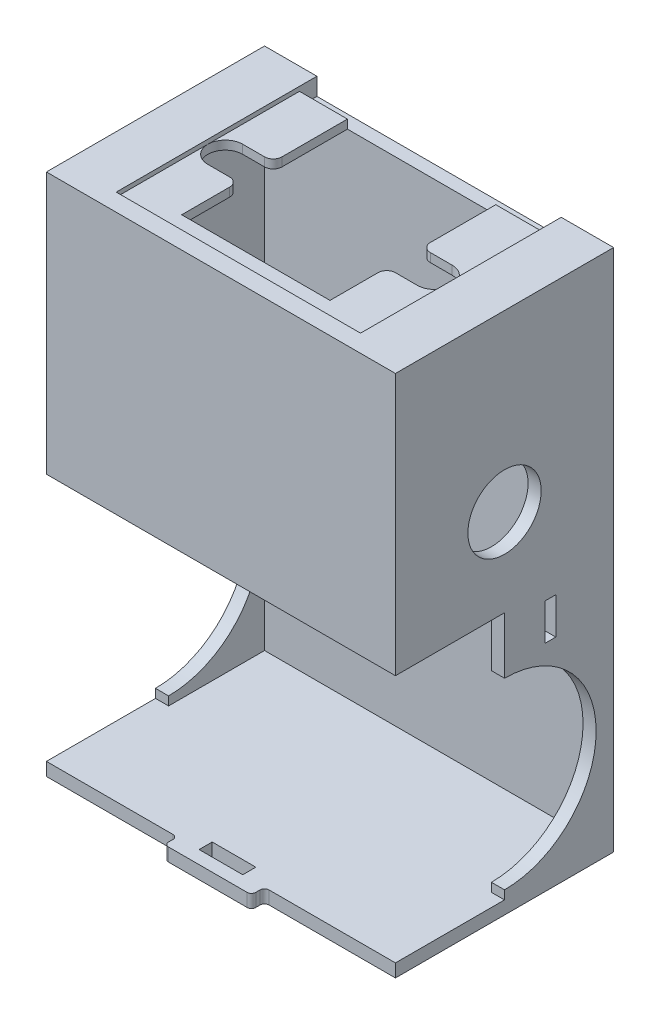
from build123d import *

# Parameters (mm, degrees)
SKETCH_1_W           = 40
SKETCH_1_H           = 60
EXTRUDE_1_DEPTH      = 25
SHELL_1_T            = -1.5
SKETCH_2_R           = 10.5
CUT_EXTRUDE_1_DEPTH  = 75
SKETCH_3_W           = 40
SKETCH_3_H           = 30
EXTRUDE_2_DEPTH      = 1
SKETCH_4_W           = 40
SKETCH_4_H           = 28.5
CUT_EXTRUDE_2_DEPTH  = 12.5
SKETCH_5_R           = 4.2
CUT_EXTRUDE_3_DEPTH  = 1.5
SKETCH_6_W           = 28
SKETCH_6_H           = 26
CUT_EXTRUDE_4_DEPTH  = 0.5
CUT_EXTRUDE_7_DEPTH  = 3.5
SKETCH_9_W           = 28
SKETCH_9_H           = 2
CUT_EXTRUDE_8_DEPTH  = 0.5
FILLET_1_R           = 1
CUT_EXTRUDE_9_DEPTH  = 1.5
SKETCH_18_W          = 10
SKETCH_18_H          = 1.5
EXTRUDE_6_DEPTH      = 1.5
SKETCH_22_W          = 5
SKETCH_22_H          = 1.5
CUT_EXTRUDE_13_DEPTH = 2
FILLET_4_R           = 0.5
SKETCH_26_W          = 1.25
SKETCH_26_H          = 4.2
CUT_EXTRUDE_15_DEPTH = 41
FILLET_5_R           = 0.2
SKETCH_17_R          = 4.2
CUT_EXTRUDE_16_DEPTH = 41
EXTRUDE_START        = 1.5
EXTRUDE_9_DEPTH      = 1.5


with BuildPart() as part:
    # 草图1 → 凸台-拉伸1 (new body)
    with BuildSketch(Plane.XY):
        Rectangle(SKETCH_1_W, SKETCH_1_H)
    extrude(amount=EXTRUDE_1_DEPTH)

    # 抽壳1
    shell_1_openings = [part.faces().sort_by_distance(p)[0] for p in [
        (0, 0, 25),
    ]]
    offset(amount=SHELL_1_T, openings=shell_1_openings, kind=Kind.INTERSECTION)

    # 草图2 → 切除-拉伸1 (cut)
    with BuildSketch(Plane(origin=(20, 0, 0), x_dir=(0, 0, -1), z_dir=(1, 0, 0))):
        with Locations((-12.5, -17)):
            Circle(SKETCH_2_R)
    extrude(amount=-CUT_EXTRUDE_1_DEPTH, mode=Mode.SUBTRACT)

    # 草图3 → 凸台-拉伸2 (add)
    with BuildSketch(Plane.XY.offset(25)):
        with Locations((0, 15)):
            Rectangle(SKETCH_3_W, SKETCH_3_H)
    extrude(amount=-EXTRUDE_2_DEPTH)

    # 草图4 → 切除-拉伸2 (cut)
    with BuildSketch(Plane.XY.offset(25)):
        with Locations((0, -14.25)):
            Rectangle(SKETCH_4_W, SKETCH_4_H)
    extrude(amount=-CUT_EXTRUDE_2_DEPTH, mode=Mode.SUBTRACT)

    # 草图5 → 切除-拉伸3 (cut)
    with BuildSketch(Plane(origin=(0, 30, 0), x_dir=(1, 0, 0), z_dir=(0, 1, 0))):
        with Locations((-20, -12.5)):
            Circle(SKETCH_5_R)
        with Locations((20, -12.5)):
            Circle(SKETCH_5_R)
    extrude(amount=-CUT_EXTRUDE_3_DEPTH, mode=Mode.SUBTRACT)

    # 草图6 → 切除-拉伸4 (cut)
    with BuildSketch(Plane(origin=(0, 30, 0), x_dir=(1, 0, 0), z_dir=(0, 1, 0))):
        with Locations((0, -8)):
            Rectangle(SKETCH_6_W, SKETCH_6_H)
    extrude(amount=-CUT_EXTRUDE_4_DEPTH, mode=Mode.SUBTRACT)

    # 草图8 → 切除-拉伸7 (cut)
    with BuildSketch(Plane(origin=(0, 29.5, 0), x_dir=(1, 0, 0), z_dir=(0, 1, 0))):
        with BuildLine():
            Line((-8.5, -4), (8.5, -4))
            Line((8.5, -4), (8.5, -10.5))
            Line((8.5, -10.5), (12, -10.5))
            ThreePointArc((12, -10.5), (14, -12.5), (12, -14.5))
            Line((12, -14.5), (8.5, -14.5))
            Line((8.5, -14.5), (8.5, -21))
            Line((8.5, -21), (-8.5, -21))
            Line((-8.5, -21), (-8.5, -14.5))
            Line((-8.5, -14.5), (-12, -14.5))
            ThreePointArc((-12, -14.5), (-14, -12.5), (-12, -10.5))
            Line((-12, -10.5), (-8.5, -10.5))
            Line((-8.5, -10.5), (-8.5, -4))
        make_face()
    extrude(amount=-CUT_EXTRUDE_7_DEPTH, mode=Mode.SUBTRACT)

    # 草图9 → 切除-拉伸8 (cut)
    with BuildSketch(Plane(origin=(0, 30, 0), x_dir=(1, 0, 0), z_dir=(0, 1, 0))):
        with Locations((0, -22)):
            Rectangle(SKETCH_9_W, SKETCH_9_H)
    extrude(amount=-CUT_EXTRUDE_8_DEPTH, mode=Mode.SUBTRACT)

    # 圆角1
    fillet_1_edges = [part.edges().sort_by_distance(p)[0] for p in [
        (8.5, 29, 14.5),
        (-8.5, 29, 14.5),
        (-8.5, 29, 10.5),
        (8.5, 29, 10.5),
    ]]
    fillet(fillet_1_edges, radius=FILLET_1_R)

    # 草图10 → 切除-拉伸9 (cut)
    with BuildSketch(Plane(origin=(0, 29.5, 0), x_dir=(1, 0, 0), z_dir=(0, 1, 0))):
        Polygon((8.5, -4), (8.5, -2), (14, -2), (14, 0), (8.5, 0), (-8.5, 0), (-14, 0), (-14, -2), (-8.5, -2), (-8.5, -4), align=None)
    extrude(amount=-CUT_EXTRUDE_9_DEPTH, mode=Mode.SUBTRACT)

    # 草图18 → 凸台-拉伸6 (add)
    with BuildSketch(Plane.XY.offset(25)):
        with Locations((0, -29.25)):
            Rectangle(SKETCH_18_W, SKETCH_18_H)
    extrude(amount=EXTRUDE_6_DEPTH)

    # 草图22 → 切除-拉伸13 (cut)
    with BuildSketch(Plane(origin=(0, -28.5, 0), x_dir=(1, 0, 0), z_dir=(0, 1, 0))):
        with Locations((0, -24.25)):
            Rectangle(SKETCH_22_W, SKETCH_22_H)
    extrude(amount=-CUT_EXTRUDE_13_DEPTH, mode=Mode.SUBTRACT)

    # 圆角4
    fillet_4_edges = [part.edges().sort_by_distance(p)[0] for p in [
        (5, -29.25, 25),
        (-5, -29.25, 25),
        (5, -29.25, 26.5),
        (-5, -29.25, 26.5),
    ]]
    fillet(fillet_4_edges, radius=FILLET_4_R)

    # 草图26 → 切除-拉伸15 (cut)
    with BuildSketch(Plane(origin=(20, 0, 0), x_dir=(0, 0, -1), z_dir=(1, 0, 0))):
        with Locations((-7.25, -3.25)):
            Rectangle(SKETCH_26_W, SKETCH_26_H)
    extrude(amount=-CUT_EXTRUDE_15_DEPTH, mode=Mode.SUBTRACT)

    # 圆角5
    fillet_5_edges = [part.edges().sort_by_distance(p)[0] for p in [
        (-18.5, -1.15, 7.25),
        (-18.5, -3.25, 7.875),
        (-18.5, -5.35, 7.25),
        (-18.5, -3.25, 6.625),
        (18.5, -3.25, 6.625),
        (18.5, -5.35, 7.25),
        (18.5, -3.25, 7.875),
        (18.5, -1.15, 7.25),
    ]]
    fillet(fillet_5_edges, radius=FILLET_5_R)

    # 草图17 → 切除-拉伸16 (cut)
    with BuildSketch(Plane(origin=(20, 0, 0), x_dir=(0, 0, -1), z_dir=(1, 0, 0))):
        with Locations((-12.5, 10)):
            Circle(SKETCH_17_R)
    extrude(amount=-CUT_EXTRUDE_16_DEPTH, mode=Mode.SUBTRACT)

    # 草图27 → 凸台-拉伸9 (add)
    with BuildSketch(Plane(origin=(0, 28.5, 0), x_dir=(1, 0, 0), z_dir=(0, 1, 0)).offset(EXTRUDE_START)):
        with BuildLine():
            Line((-20, -8.3), (-20, -16.7))
            ThreePointArc((-20, -16.7), (-15.8, -12.5), (-20, -8.3))
        make_face()
        with BuildLine():
            Line((20, -8.3), (20, -16.7))
            ThreePointArc((20, -16.7), (15.8, -12.5), (20, -8.3))
        make_face()
    extrude(amount=-EXTRUDE_9_DEPTH)


solid = part.part
